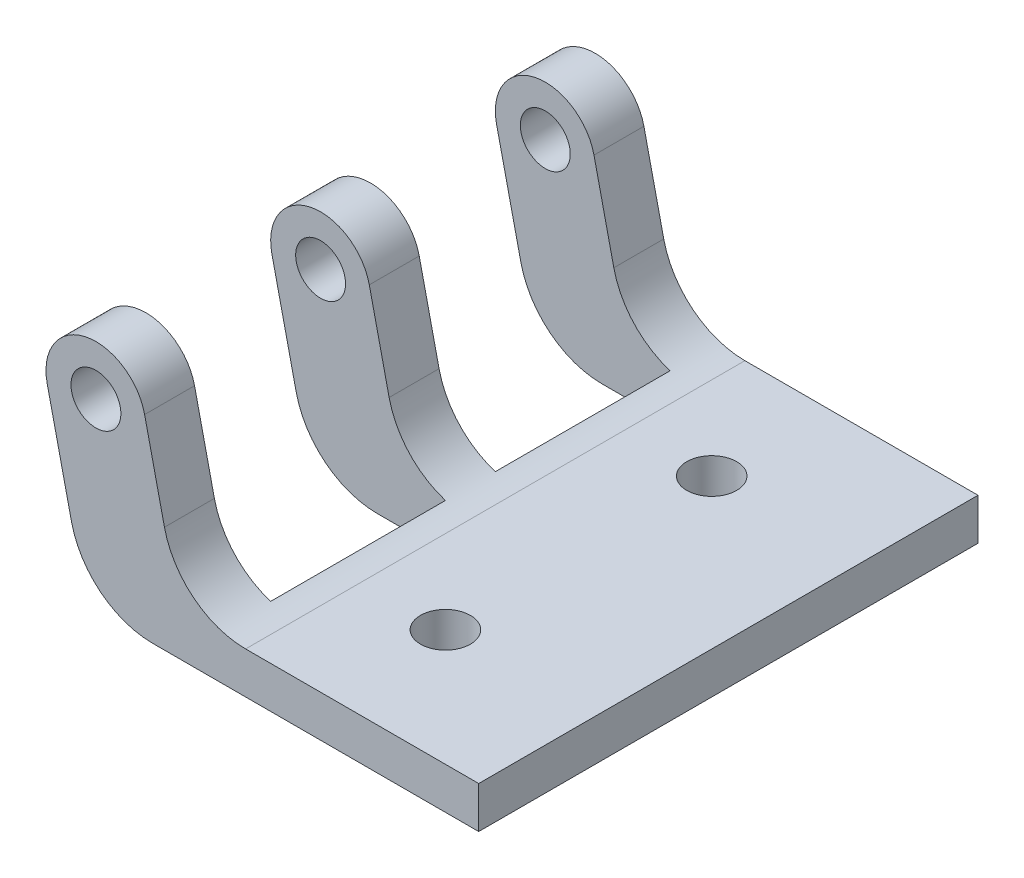
from build123d import *

# Parameters (mm, degrees)
ESBO_O1_R                  = 1.5
RESSALTO_EXTRUS_O1_DEPTH   = 30
FILETE1_R                  = 5
CORTE_EXTRUS_O1_DEPTH      = 37.349002737
CORTE_EXTRUS_O1_DEPTH_BACK = 37.349002737
ESBO_O2_R                  = 1.5
ESBO_O2_W                  = 10.5
ESBO_O2_H                  = 10.5


with BuildPart() as part:
    # Esboço1 → Ressalto-extrusão1 (new body)
    with BuildSketch(Plane.XY):
        with BuildLine():
            Line((-9, 0), (9, 0))
            Line((9, 0), (9, -2.5))
            Line((9, -2.5), (-14.585891007, -2.5))
            Line((-14.585891007, -2.5), (-16.925971737, 7.837663684))
            ThreePointArc((-16.925971737, 7.837663684), (-14.662336316, 11.425971737), (-11.074028263, 9.162336316))
            Line((-11.074028263, 9.162336316), (-9, 0))
        make_face()
        with Locations((-14, 8.5)):
            Circle(ESBO_O1_R, mode=Mode.SUBTRACT)
    extrude(amount=RESSALTO_EXTRUS_O1_DEPTH)

    # Filete1
    filete1_edges = [part.edges().sort_by_distance(p)[0] for p in [
        (-14.585891007, -2.5, 15),
        (-9, 0, 15),
    ]]
    fillet(filete1_edges, radius=FILETE1_R)

    # Esboço2 → Corte-extrusão1 (cut, two sides: drawn at the far end of the back side and taken through both)
    with BuildSketch(Plane(origin=(0, 0, 0), x_dir=(1, 0, 0), z_dir=(0, 1, 0)).offset(-CORTE_EXTRUS_O1_DEPTH_BACK)):
        with Locations(Location((0, -7, 0), (0, 0, 180))):
            Circle(ESBO_O2_R)
        with Locations(Location((0, -23, 0), (0, 0, 180))):
            Circle(ESBO_O2_R)
        with Locations((-11.75, -8.25)):
            Rectangle(ESBO_O2_W, ESBO_O2_H)
        with Locations((-11.75, -21.75)):
            Rectangle(ESBO_O2_W, ESBO_O2_H)
    extrude(amount=CORTE_EXTRUS_O1_DEPTH + CORTE_EXTRUS_O1_DEPTH_BACK, mode=Mode.SUBTRACT)


solid = part.part
